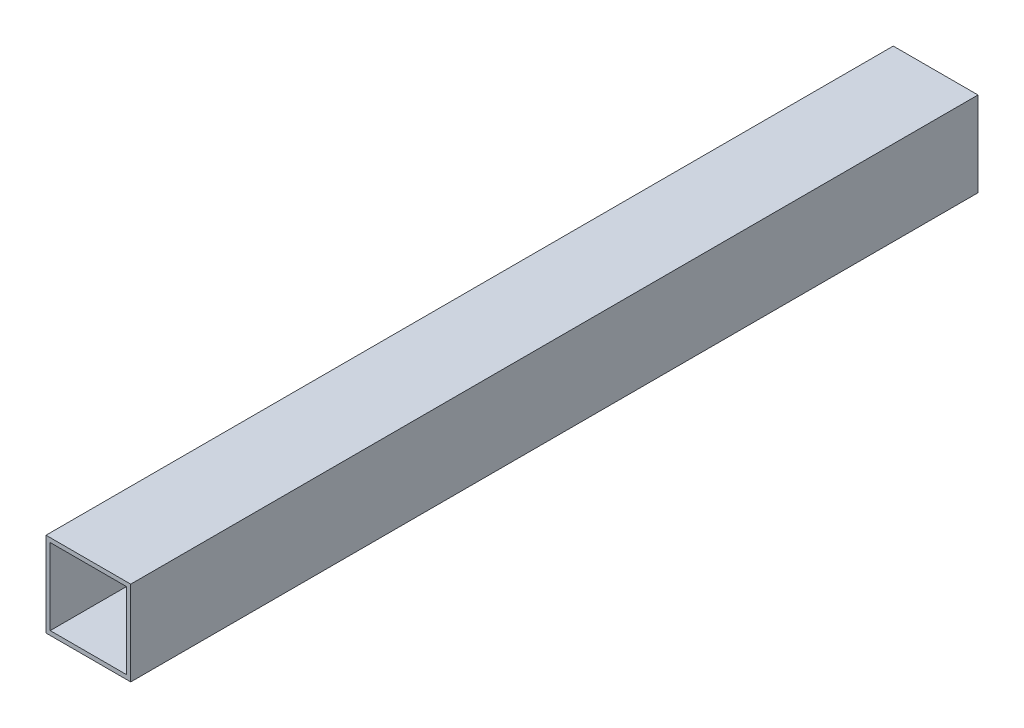
from build123d import *

# Parameters (mm, degrees)
SKETCH1_W           = 100
SKETCH1_H           = 100
SKETCH1_W_2         = 90
SKETCH1_H_2         = 90
BOSS_EXTRUDE1_DEPTH = 500


with BuildPart() as part:
    # Sketch1 → Boss-Extrude1 (new, symmetric)
    with BuildSketch(Plane.XY):
        Rectangle(SKETCH1_W, SKETCH1_H)
        Rectangle(SKETCH1_W_2, SKETCH1_H_2, mode=Mode.SUBTRACT)
    extrude(amount=BOSS_EXTRUDE1_DEPTH, both=True)


solid = part.part
